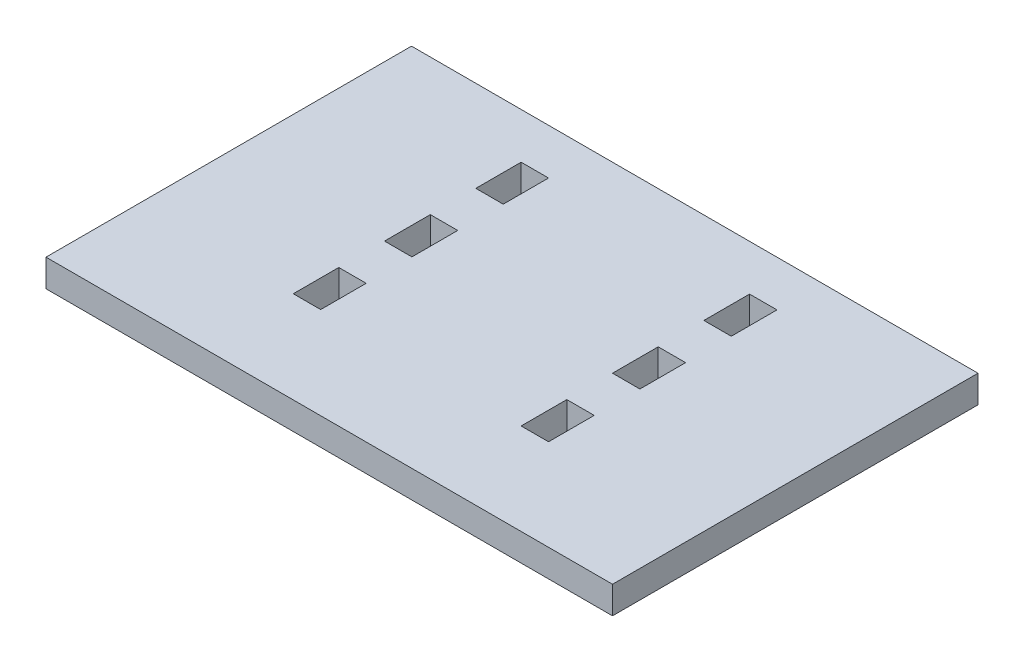
from build123d import *

# Parameters (mm, degrees)
BOSS_EXTRUDE1_DEPTH = 3


with BuildPart() as part:
    # Sketch1 → Boss-Extrude1 (new body)
    with BuildSketch(Plane(origin=(0, 0, 0), x_dir=(1, 0, 0), z_dir=(0, 1, 0))):
        Polygon((0, 10.062770525), (0, 0), (11, 0), (11, 40), (0, 40), (0, 35), (0, 30.039695182), (0, 25.060174836), (0, 20.045653409), (0, 15.041922169), align=None)
        Polygon((-20, 0), (0, 0), (0, 10.062770525), (-3, 10.062770525), (-3, 15.041922169), (0, 15.041922169), (0, 20.045653409), (-3, 20.045653409), (-3, 25.060174836), (0, 25.060174836), (0, 30.039695182), (-3, 30.039695182), (-3, 35), (0, 35), (0, 40), (-20, 40), align=None)
        Polygon((11, 40), (11, 0), (22, 0), (22, 10), (22, 15), (22, 20), (22, 25), (22, 30), (22, 35), (22, 40), align=None)
        Polygon((22, 10), (22, 0), (42, 0), (42, 40), (22, 40), (22, 35), (24.998112264, 35), (24.998112264, 30), (22, 30), (22, 25), (24.998112264, 25), (24.998112264, 20), (22, 20), (22, 15), (24.998112264, 15), (24.998112264, 10), align=None)
    extrude(amount=BOSS_EXTRUDE1_DEPTH)


solid = part.part
